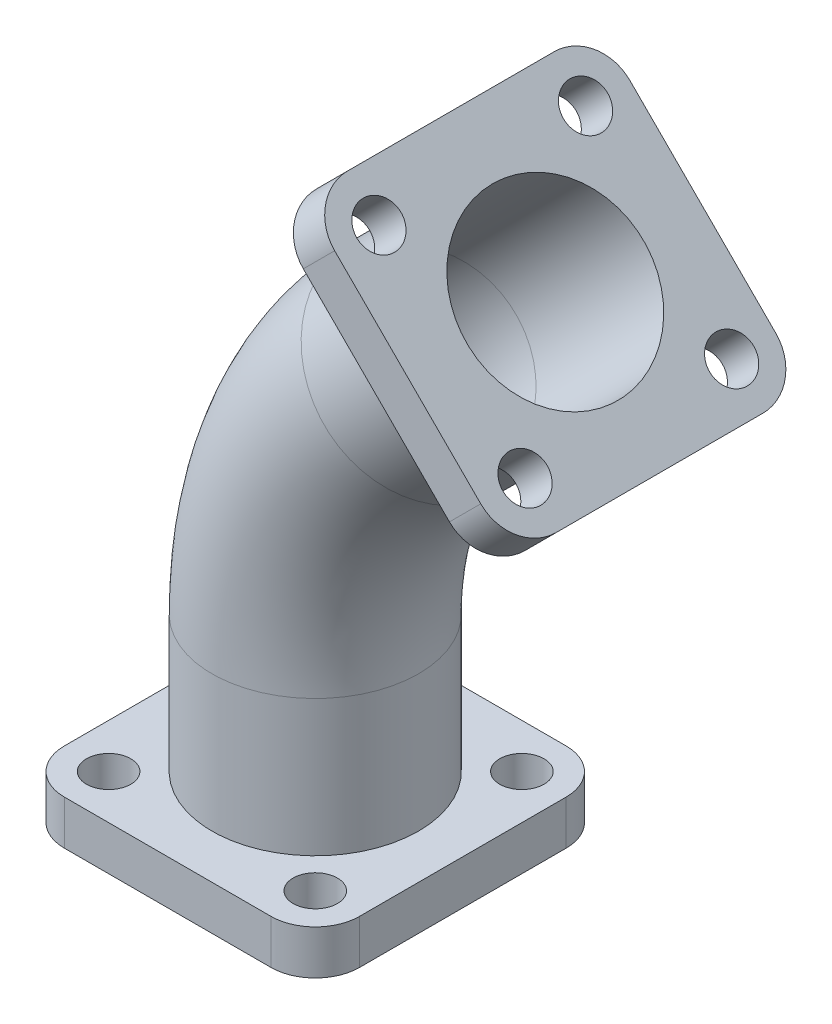
from build123d import *

# Parameters (mm, degrees)
CROQUIS1_W               = 100
CROQUIS1_H               = 15
SALIENTE_EXTRUIR1_DEPTH  = 50
CROQUIS17_R              = 30
CORTAR_EXTRUIR1_DEPTH    = 15
BARRER1_PROFILE_R        = 35
CORTAR_BARRER2_PROFILE_R = 30
REDONDEO1_R              = 15
TALADRO1_D               = 15
TALADRO1_DEPTH           = 15
CROQUIS26_W              = 100
CROQUIS26_H              = 100
SALIENTE_EXTRUIR3_DEPTH  = 15
REDONDEO2_R              = 15
CROQUIS29_R              = 30
CORTAR_EXTRUIR2_DEPTH    = 15
TALADRO2_D               = 15
TALADRO2_DEPTH           = 15
TALADRO2_ON_FACE_2_D     = 15
TALADRO2_ON_FACE_2_DEPTH = 15


with BuildPart() as part:
    # Croquis1 → Saliente-Extruir1 (new, symmetric)
    with BuildSketch(Plane.XY):
        with Locations((0, 7.5)):
            Rectangle(CROQUIS1_W, CROQUIS1_H)
    extrude(amount=SALIENTE_EXTRUIR1_DEPTH, both=True)

    # Croquis17 → Cortar-Extruir1 (cut)
    with BuildSketch(Plane(origin=(0, 15, 0), x_dir=(1, 0, 0), z_dir=(0, 1, 0))):
        with Locations(Location((0, 0, 0), (0, 0, 180))):
            Circle(CROQUIS17_R)
    extrude(amount=-CORTAR_EXTRUIR1_DEPTH, mode=Mode.SUBTRACT)

    # Barrer1: sweep along a path in Croquis2
    with BuildLine(Plane.XY) as barrer1_path:
        Line((0, 0), (0, 61.152236891))
        ThreePointArc((0, 61.152236891), (9.895660774, 110.901083099), (38.076118446, 153.076118446))
        Line((38.076118446, 153.076118446), (70.710678119, 185.710678119))
    # Barrer1 profile (on start of the path) → Barrer1 (sweep)
    with BuildSketch(Plane(origin=(0, 0, 0), x_dir=(1, 0, 0), z_dir=(0, 1, 0))):
        Circle(BARRER1_PROFILE_R)
    sweep(path=barrer1_path.line)

    # Cortar-Barrer2: sweep along a path in Croquis2<5>
    with BuildLine(Plane.XY) as cortar_barrer2_path:
        Line((0, 0), (0, 61.152236891))
        ThreePointArc((0, 61.152236891), (9.895660774, 110.901083099), (38.076118446, 153.076118446))
        Line((38.076118446, 153.076118446), (70.710678119, 185.710678119))
    # Cortar-Barrer2 profile (on start of the path) → Cortar-Barrer2 (sweep, cut)
    with BuildSketch(Plane(origin=(0, 0, 0), x_dir=(1, 0, 0), z_dir=(0, 1, 0))):
        Circle(CORTAR_BARRER2_PROFILE_R)
    sweep(path=cortar_barrer2_path.line, mode=Mode.SUBTRACT)

    # Redondeo1
    redondeo1_edges = [part.edges().sort_by_distance(p)[0] for p in [
        (50, 7.5, 50),
        (-50, 7.5, 50),
        (50, 7.5, -50),
        (-50, 7.5, -50),
    ]]
    fillet(redondeo1_edges, radius=REDONDEO1_R)

    # Taladro1
    with Locations(Plane(origin=(-35, 15, -35), x_dir=(1, 0, 0), z_dir=(0, 1, 0))):
        with Locations((0, 0), (0, -70), (70, 0), (70, -70)):
            Hole(TALADRO1_D / 2, depth=TALADRO1_DEPTH)

    # Croquis26 → Saliente-Extruir3 (add)
    with BuildSketch(Plane(origin=(128.210678119, 128.210678119, 0), x_dir=(0, 0, -1), z_dir=(0.7071067811865478, 0.7071067811865472, 0))):
        with Locations((0, 81.317279836)):
            Rectangle(CROQUIS26_W, CROQUIS26_H)
    extrude(amount=SALIENTE_EXTRUIR3_DEPTH)

    # Redondeo2
    redondeo2_edges = [part.edges().sort_by_distance(p)[0] for p in [
        (40.658639918, 226.369318037, 50),
        (111.369318037, 155.658639918, 50),
        (111.369318037, 155.658639918, -50),
        (40.658639918, 226.369318037, -50),
    ]]
    fillet(redondeo2_edges, radius=REDONDEO2_R)

    # Croquis29 → Cortar-Extruir2 (cut)
    with BuildSketch(Plane(origin=(138.817279836, 138.817279836, 0), x_dir=(0, 0, -1), z_dir=(0.7071067811865479, 0.7071067811865472, 0))):
        with Locations(Location((0, 81.317279836, 0), (0, 0, 90))):
            Circle(CROQUIS29_R)
    extrude(amount=-CORTAR_EXTRUIR2_DEPTH, mode=Mode.SUBTRACT)

    # Taladro2
    with Locations(Plane(origin=(56.568542495, 221.066017178, 35), x_dir=(-0.707106781187, 0.707106781187, 0), z_dir=(0.707106781187, 0.707106781187, 0))):
        with Locations((0, 0)):
            Hole(TALADRO2_D / 2, depth=TALADRO2_DEPTH)

    # Taladro2 on face 2
    with Locations(Plane(origin=(106.066017178, 171.568542495, 35), x_dir=(0.707106781187, -0.707106781187, 0), z_dir=(0.707106781187, 0.707106781187, 0))):
        with Locations((0, 0), (0, 70), (-70, 70)):
            Hole(TALADRO2_ON_FACE_2_D / 2, depth=TALADRO2_ON_FACE_2_DEPTH)


solid = part.part
